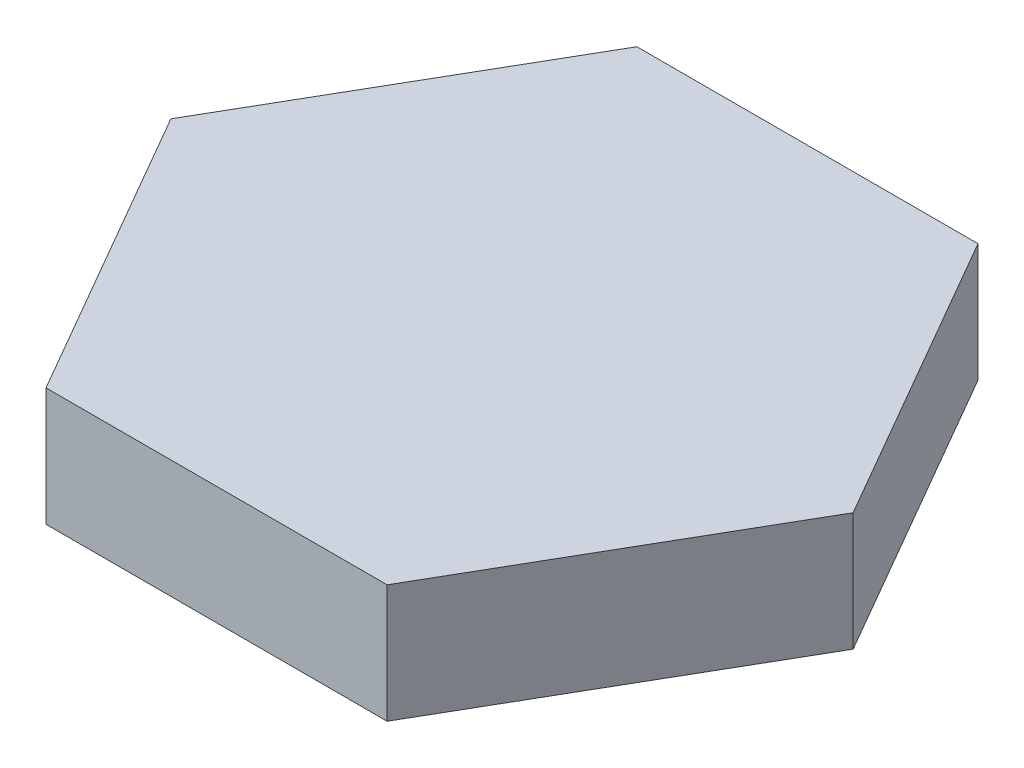
from build123d import *

# Parameters (mm, degrees)
BOSS_EXTRUDE1_DEPTH = 10


with BuildPart() as part:
    # Sketch1 → Boss-Extrude1 (new, symmetric)
    with BuildSketch(Plane(origin=(0, 0, 0), x_dir=(1, 0, 0), z_dir=(0, 1, 0))):
        Polygon((28.867513459, 50), (-28.867513459, 50), (-57.735026919, 0), (-28.867513459, -50), (28.867513459, -50), (57.735026919, 0), align=None)
    extrude(amount=BOSS_EXTRUDE1_DEPTH, both=True)


solid = part.part
